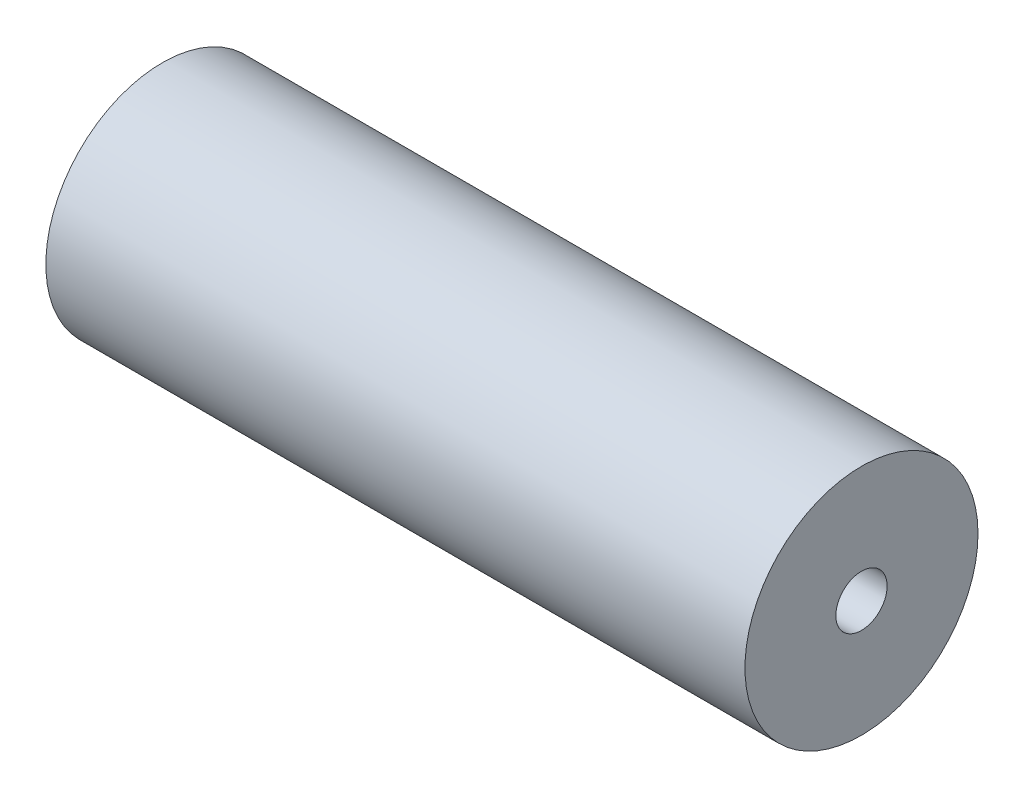
from build123d import *

# Parameters (mm, degrees)
ESQUISSE1_R             = 10
BOSS_EXTRU_1_DEPTH      = 60
ESQUISSE2_R             = 2.2
ENL_V_MAT_EXTRU_1_DEPTH = 60


with BuildPart() as part:
    # Esquisse1 → Boss.-Extru.1 (new body)
    with BuildSketch(Plane(origin=(0, 0, 0), x_dir=(0, 0, -1), z_dir=(1, 0, 0))):
        Circle(ESQUISSE1_R)
    extrude(amount=BOSS_EXTRU_1_DEPTH)

    # Esquisse2 → Enlèv. mat.-Extru.1 (cut)
    with BuildSketch(Plane.ZY):
        Circle(ESQUISSE2_R)
    extrude(amount=-ENL_V_MAT_EXTRU_1_DEPTH, mode=Mode.SUBTRACT)


solid = part.part
